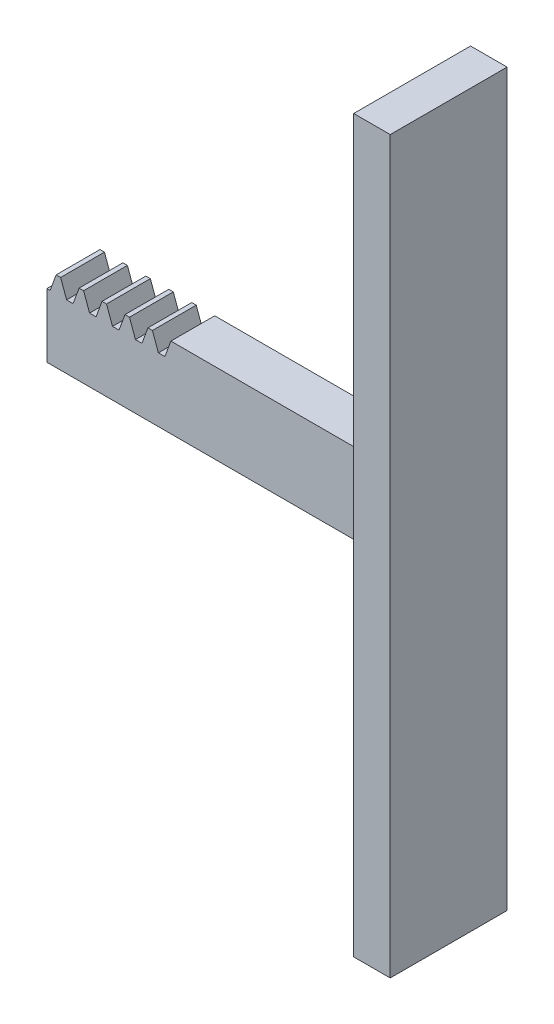
from build123d import *

# Parameters (mm, degrees)
BLANKSKE_W        = 17
BLANKSKE_H        = 11
BLANK_DEPTH       = 6
TOOTHCUTSIM_DEPTH = 22.118712082
TEETHCUTS_COUNT   = 6
TEETHCUTS_PITCH   = 3.14159265
SKETCH_1_W        = 6
SKETCH_1_H        = 11
EXTRUDE_1_DEPTH   = 30
SKETCH_2_W        = 16
SKETCH_2_H        = 100
EXTRUDE_2_DEPTH   = 5


with BuildPart() as part:
    # BlankSke → Blank (new body)
    with BuildSketch(Plane.XY):
        with Locations((8.5, 5.5)):
            Rectangle(BLANKSKE_W, BLANKSKE_H)
    extrude(amount=-BLANK_DEPTH)

    # TooCutSkeSim → ToothCutSim (cut, through all)
    with BuildSketch(Plane.XY):
        Polygon((0.44443537, 8.75), (-0.44443537, 8.75), (-1.272613241, 11.0254), (1.272613241, 11.0254), align=None)
    toothcutsim = extrude(amount=-TOOTHCUTSIM_DEPTH, mode=Mode.SUBTRACT)

    # TeethCuts: ToothCutSim ×6
    with Locations(*[(i * TEETHCUTS_PITCH, 0, 0) for i in range(1, TEETHCUTS_COUNT)]):
        add(toothcutsim, mode=Mode.SUBTRACT)

    # 草图1 → 凸台-拉伸1 (add)
    with BuildSketch(Plane(origin=(17, 0, 0), x_dir=(0, 0, -1), z_dir=(1, 0, 0))):
        with Locations((3, 5.5)):
            Rectangle(SKETCH_1_W, SKETCH_1_H)
    extrude(amount=EXTRUDE_1_DEPTH)

    # 草图2 → 凸台-拉伸2 (add)
    with BuildSketch(Plane(origin=(47, 0, 0), x_dir=(0, 0, -1), z_dir=(1, 0, 0))):
        with Locations((3, 5.5)):
            Rectangle(SKETCH_2_W, SKETCH_2_H)
    extrude(amount=EXTRUDE_2_DEPTH)


solid = part.part
